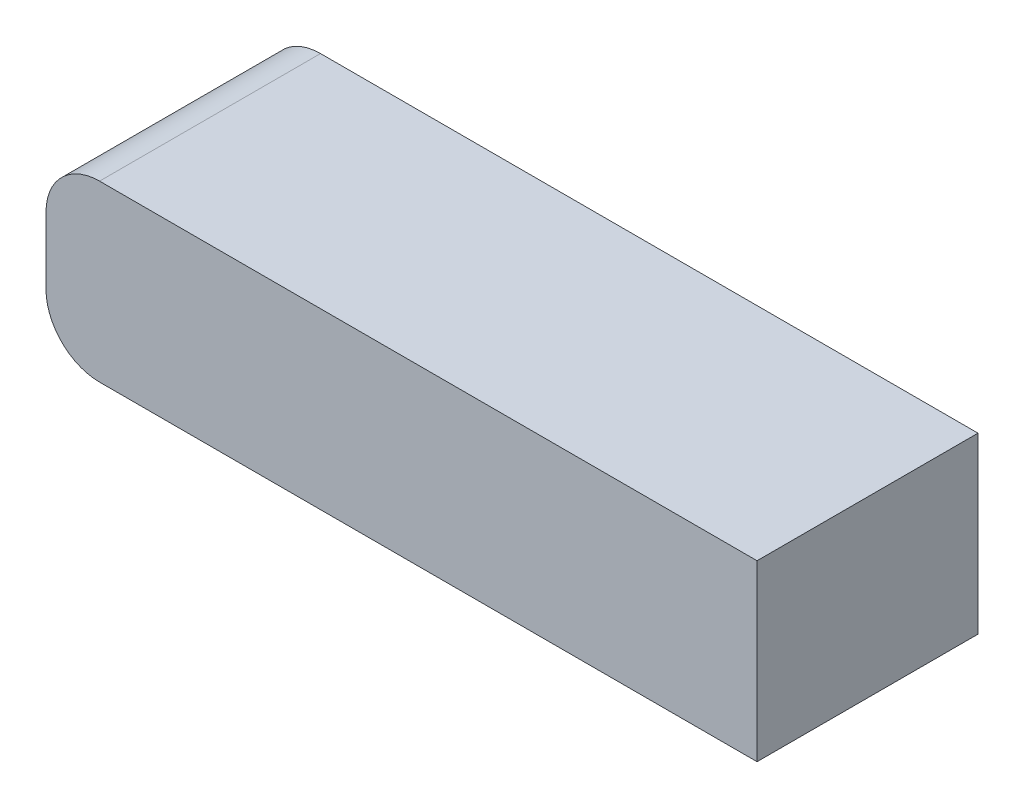
from build123d import *

# Parameters (mm, degrees)
SKETCH1_W           = 134.874
SKETCH1_H           = 41.91
BOSS_EXTRUDE1_DEPTH = 33.02
FILLET1_R           = 10.16


with BuildPart() as part:
    # Sketch1 → Boss-Extrude1 (new body)
    with BuildSketch(Plane(origin=(0, 0, 0), x_dir=(1, 0, 0), z_dir=(0, 1, 0))):
        Rectangle(SKETCH1_W, SKETCH1_H)
    extrude(amount=BOSS_EXTRUDE1_DEPTH)

    # Fillet1
    fillet1_edges = [part.edges().sort_by_distance(p)[0] for p in [
        (-67.437, 33.02, 0),
        (-67.437, 0, 0),
    ]]
    fillet(fillet1_edges, radius=FILLET1_R)


solid = part.part
